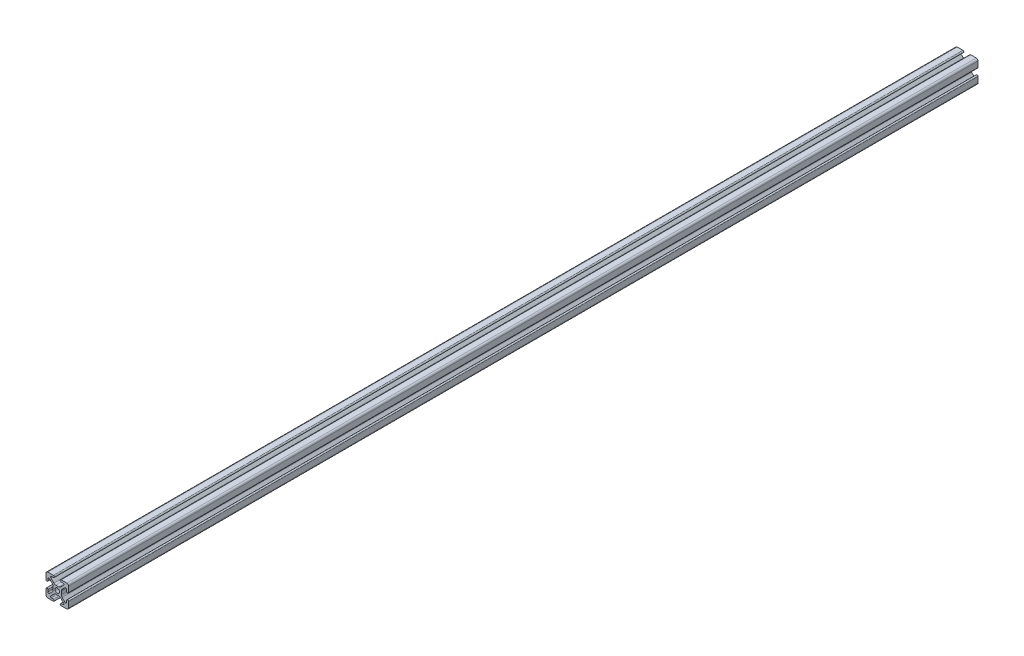
from build123d import *

# Parameters (mm, degrees)
SKETCH1_R      = 2.5
EXTRUDE1_DEPTH = 1011.05


with BuildPart() as part:
    # Sketch1 → Extrude1 (new body)
    with BuildSketch(Plane.XY):
        with BuildLine():
            Line((-8.636346088, 7.111588351), (-5.432204773, 3.912143135))
            ThreePointArc((-5.432204773, 3.912143135), (-4.708985779, 2.831057106), (-4.455, 1.555406707))
            Line((-4.455, 1.555406707), (-4.455, -1.555406707))
            ThreePointArc((-4.455, -1.555406707), (-4.708985779, -2.831057106), (-5.432204773, -3.912143135))
            Line((-5.432204773, -3.912143135), (-8.636346088, -7.111588351))
            ThreePointArc((-8.636346088, -7.111588351), (-9.736852394, -7.329863489), (-10.36, -6.396886949))
            Line((-10.36, -6.396886949), (-10.36, -4.32))
            ThreePointArc((-10.36, -4.32), (-11.43, -3.25), (-12.5, -4.32))
            Line((-12.5, -4.32), (-12.5, -8.651801989))
            Line((-12.5, -8.651801989), (-12.5, -10.537068835))
            ThreePointArc((-12.5, -10.537068835), (-11.925070773, -11.925070773), (-10.537068835, -12.5))
            Line((-10.537068835, -12.5), (-8.441567612, -12.5))
            Line((-8.441567612, -12.5), (-4.387856959, -12.5))
            ThreePointArc((-4.387856959, -12.5), (-3.317856959, -11.43), (-4.387856959, -10.36))
            Line((-4.387856959, -10.36), (-6.42, -10.36))
            ThreePointArc((-6.42, -10.36), (-7.35325999, -9.736168088), (-7.133653912, -8.635298598))
            Line((-7.133653912, -8.635298598), (-3.795290766, -5.301828272))
            ThreePointArc((-3.795290766, -5.301828272), (-2.76743922, -4.61585726), (-1.555406707, -4.375))
            Line((-1.555406707, -4.375), (1.555406707, -4.375))
            ThreePointArc((1.555406707, -4.375), (2.76743922, -4.61585726), (3.795290766, -5.301828272))
            Line((3.795290766, -5.301828272), (7.133653912, -8.635298598))
            ThreePointArc((7.133653912, -8.635298598), (7.35325999, -9.736168088), (6.42, -10.36))
            Line((6.42, -10.36), (4.387856959, -10.36))
            ThreePointArc((4.387856959, -10.36), (3.317856959, -11.43), (4.387856959, -12.5))
            Line((4.387856959, -12.5), (8.441567612, -12.5))
            Line((8.441567612, -12.5), (10.537068835, -12.5))
            ThreePointArc((10.537068835, -12.5), (11.925070773, -11.925070773), (12.5, -10.537068835))
            Line((12.5, -10.537068835), (12.5, -8.651801989))
            Line((12.5, -8.651801989), (12.5, -4.32))
            ThreePointArc((12.5, -4.32), (11.43, -3.25), (10.36, -4.32))
            Line((10.36, -4.32), (10.36, -6.396886949))
            ThreePointArc((10.36, -6.396886949), (9.736852394, -7.329863489), (8.636346088, -7.111588351))
            Line((8.636346088, -7.111588351), (5.432204773, -3.912143135))
            ThreePointArc((5.432204773, -3.912143135), (4.708985779, -2.831057106), (4.455, -1.555406707))
            Line((4.455, -1.555406707), (4.455, 1.555406707))
            ThreePointArc((4.455, 1.555406707), (4.708985779, 2.831057106), (5.432204773, 3.912143135))
            Line((5.432204773, 3.912143135), (8.636346088, 7.111588351))
            ThreePointArc((8.636346088, 7.111588351), (9.736852394, 7.329863489), (10.36, 6.396886949))
            Line((10.36, 6.396886949), (10.36, 4.32))
            ThreePointArc((10.36, 4.32), (11.43, 3.25), (12.5, 4.32))
            Line((12.5, 4.32), (12.5, 7.99129648))
            Line((12.5, 7.99129648), (12.5, 10.537068835))
            ThreePointArc((12.5, 10.537068835), (11.925070773, 11.925070773), (10.537068835, 12.5))
            Line((10.537068835, 12.5), (4.32, 12.5))
            ThreePointArc((4.32, 12.5), (3.25, 11.43), (4.32, 10.36))
            Line((4.32, 10.36), (6.42, 10.36))
            ThreePointArc((6.42, 10.36), (7.35325999, 9.736168088), (7.133653912, 8.635298598))
            Line((7.133653912, 8.635298598), (3.795290766, 5.301828272))
            ThreePointArc((3.795290766, 5.301828272), (2.76743922, 4.61585726), (1.555406707, 4.375))
            Line((1.555406707, 4.375), (-1.555406707, 4.375))
            ThreePointArc((-1.555406707, 4.375), (-2.76743922, 4.61585726), (-3.795290766, 5.301828272))
            Line((-3.795290766, 5.301828272), (-7.133653912, 8.635298598))
            ThreePointArc((-7.133653912, 8.635298598), (-7.35325999, 9.736168088), (-6.42, 10.36))
            Line((-6.42, 10.36), (-4.32, 10.36))
            ThreePointArc((-4.32, 10.36), (-3.25, 11.43), (-4.32, 12.5))
            Line((-4.32, 12.5), (-10.537068835, 12.5))
            ThreePointArc((-10.537068835, 12.5), (-11.925070773, 11.925070773), (-12.5, 10.537068835))
            Line((-12.5, 10.537068835), (-12.5, 7.99129648))
            Line((-12.5, 7.99129648), (-12.5, 4.32))
            ThreePointArc((-12.5, 4.32), (-11.43, 3.25), (-10.36, 4.32))
            Line((-10.36, 4.32), (-10.36, 6.396886949))
            ThreePointArc((-10.36, 6.396886949), (-9.736852394, 7.329863489), (-8.636346088, 7.111588351))
        make_face()
        Circle(SKETCH1_R, mode=Mode.SUBTRACT)
    extrude(amount=-EXTRUDE1_DEPTH)


solid = part.part
